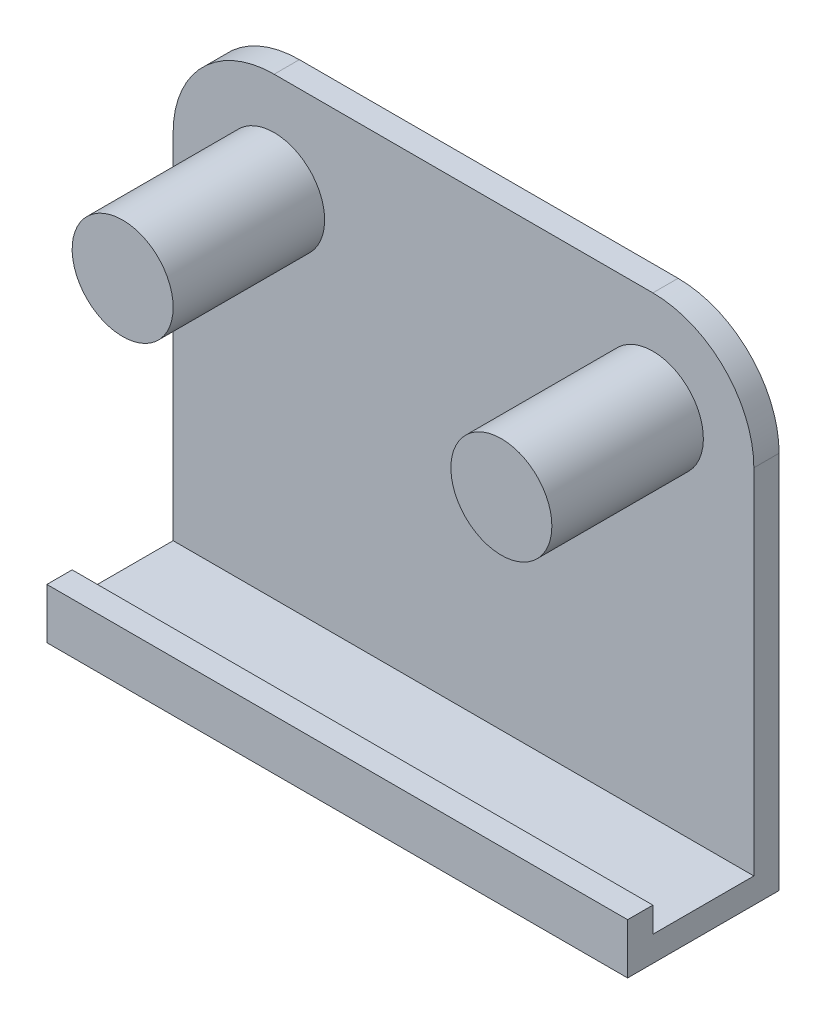
from build123d import *

# Parameters (mm, degrees)
EXTRUDE_THIN1_DEPTH = 115
FILLET1_R           = 20
SKETCH2_R           = 10
BOSS_EXTRUDE1_DEPTH = 30


with BuildPart() as part:
    # Sketch1 → Extrude-Thin1 (new body)
    with BuildSketch(Plane(origin=(0, 0, 0), x_dir=(0, 0, -1), z_dir=(1, 0, 0))):
        Polygon((0, 95), (0, 0), (-30, 0), (-30, 10), (-25, 10), (-25, 5), (-5, 5), (-5, 95), align=None)
    extrude(amount=EXTRUDE_THIN1_DEPTH)

    # Fillet1
    fillet1_edges = [part.edges().sort_by_distance(p)[0] for p in [
        (115, 95, 2.5),
        (0, 95, 2.5),
    ]]
    fillet(fillet1_edges, radius=FILLET1_R)

    # Sketch2 → Boss-Extrude1 (add)
    with BuildSketch(Plane.XY.offset(5)):
        with Locations(Location((20, 75, 0), (0, 0, 90))):
            Circle(SKETCH2_R)
        with Locations(Location((95, 75, 0), (0, 0, 90))):
            Circle(SKETCH2_R)
    extrude(amount=BOSS_EXTRUDE1_DEPTH)


solid = part.part
